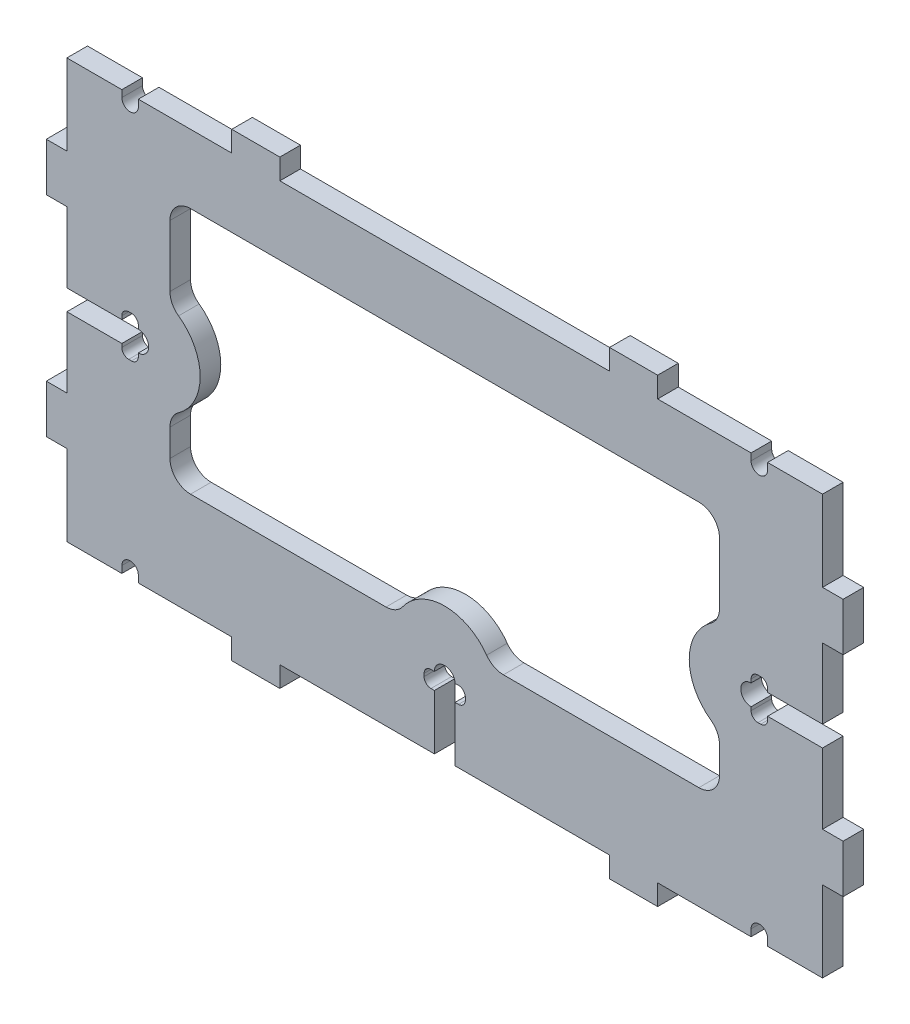
from build123d import *

# Parameters (mm, degrees)
BOSS_EXTRUDE1_DEPTH = 3
CUT_EXTRUDE1_DEPTH  = 3
CUT_EXTRUDE3_DEPTH  = 3
FILLET2_R           = 1
CUT_EXTRUDE4_DEPTH  = 10
FILLET3_R           = 3
SKETCH5_W           = 3
SKETCH5_H           = 7
SKETCH5_W_2         = 7
SKETCH5_H_2         = 3
BOSS_EXTRUDE2_DEPTH = 3


with BuildPart() as part:
    # Sketch1 → Boss-Extrude1 (new body)
    with BuildSketch(Plane.XY):
        with BuildLine():
            Line((55, 30.5), (-55, 30.5))
            Line((-55, 30.5), (-55, 1.5))
            Line((-55, 1.5), (-47, 1.5))
            Line((-47, 1.5), (-47, 2))
            Line((-47, 2), (-47, 3))
            Line((-47, 3), (-46, 3))
            Line((-46, 3), (-45.6, 3))
            Line((-45.6, 3), (-44.6, 3))
            Line((-44.6, 3), (-44.6, 2))
            Line((-44.6, 2), (-44.6, 1.5))
            ThreePointArc((-44.6, 1.5), (-43.1, 0), (-44.6, -1.5))
            Line((-44.6, -1.5), (-44.6, -2))
            Line((-44.6, -2), (-44.6, -3))
            Line((-44.6, -3), (-45.6, -3))
            Line((-45.6, -3), (-46, -3))
            Line((-46, -3), (-47, -3))
            Line((-47, -3), (-47, -2))
            Line((-47, -2), (-47, -1.5))
            Line((-47, -1.5), (-55, -1.5))
            Line((-55, -1.5), (-55, -30.5))
            Line((-55, -30.5), (55, -30.5))
            Line((55, -30.5), (55, -1.5))
            Line((55, -1.5), (47, -1.5))
            Line((47, -1.5), (47, -2))
            Line((47, -2), (47, -3))
            Line((47, -3), (46, -3))
            Line((46, -3), (45.6, -3))
            Line((45.6, -3), (44.6, -3))
            Line((44.6, -3), (44.6, -2))
            Line((44.6, -2), (44.6, -1.5))
            ThreePointArc((44.6, -1.5), (43.1, 0), (44.6, 1.5))
            Line((44.6, 1.5), (44.6, 2))
            Line((44.6, 2), (44.6, 3))
            Line((44.6, 3), (45.6, 3))
            Line((45.6, 3), (46, 3))
            Line((46, 3), (47, 3))
            Line((47, 3), (47, 2))
            Line((47, 2), (47, 1.5))
            Line((47, 1.5), (55, 1.5))
            Line((55, 1.5), (55, 30.5))
        make_face()
        with BuildLine():
            ThreePointArc((-46, -3), (-46.707106781, -2.707106781), (-47, -2))
            Line((-47, -2), (-47, -3))
            Line((-47, -3), (-46, -3))
        make_face()
        with BuildLine():
            ThreePointArc((-44.6, -2), (-44.892893219, -2.707106781), (-45.6, -3))
            Line((-45.6, -3), (-44.6, -3))
            Line((-44.6, -3), (-44.6, -2))
        make_face()
        with BuildLine():
            Line((-44.6, 3), (-45.6, 3))
            ThreePointArc((-45.6, 3), (-44.892893219, 2.707106781), (-44.6, 2))
            Line((-44.6, 2), (-44.6, 3))
        make_face()
        with BuildLine():
            Line((-47, 3), (-47, 2))
            ThreePointArc((-47, 2), (-46.707106781, 2.707106781), (-46, 3))
            Line((-46, 3), (-47, 3))
        make_face()
        with BuildLine():
            Line((44.6, -3), (45.6, -3))
            ThreePointArc((45.6, -3), (44.892893219, -2.707106781), (44.6, -2))
            Line((44.6, -2), (44.6, -3))
        make_face()
        with BuildLine():
            Line((47, -3), (47, -2))
            ThreePointArc((47, -2), (46.707106781, -2.707106781), (46, -3))
            Line((46, -3), (47, -3))
        make_face()
        with BuildLine():
            ThreePointArc((46, 3), (46.707106781, 2.707106781), (47, 2))
            Line((47, 2), (47, 3))
            Line((47, 3), (46, 3))
        make_face()
        with BuildLine():
            ThreePointArc((44.6, 2), (44.892893219, 2.707106781), (45.6, 3))
            Line((45.6, 3), (44.6, 3))
            Line((44.6, 3), (44.6, 2))
        make_face()
    extrude(amount=BOSS_EXTRUDE1_DEPTH)

    # Sketch2 → Cut-Extrude1 (cut)
    with BuildSketch(Plane.XY.offset(3)):
        with BuildLine():
            Line((45.136675042, 30.5), (44.6, 30.5))
            Line((44.6, 30.5), (44.6, 29.5))
            ThreePointArc((44.6, 29.5), (45.8, 28.3), (47, 29.5))
            Line((47, 29.5), (47, 30.5))
            Line((47, 30.5), (46.463324958, 30.5))
            Line((46.463324958, 30.5), (45.136675042, 30.5))
        make_face()
        with BuildLine():
            Line((44.6, -29.5), (44.6, -30.5))
            Line((44.6, -30.5), (45.136675042, -30.5))
            Line((45.136675042, -30.5), (46.463324958, -30.5))
            Line((46.463324958, -30.5), (47, -30.5))
            Line((47, -30.5), (47, -29.5))
            ThreePointArc((47, -29.5), (45.8, -28.3), (44.6, -29.5))
        make_face()
        with BuildLine():
            ThreePointArc((-44.6, -29.5), (-45.8, -28.3), (-47, -29.5))
            Line((-47, -29.5), (-47, -30.5))
            Line((-47, -30.5), (-46.463324958, -30.5))
            Line((-46.463324958, -30.5), (-45.136675042, -30.5))
            Line((-45.136675042, -30.5), (-44.6, -30.5))
            Line((-44.6, -30.5), (-44.6, -29.5))
        make_face()
        with BuildLine():
            Line((-47, 30.5), (-47, 29.5))
            ThreePointArc((-47, 29.5), (-45.8, 28.3), (-44.6, 29.5))
            Line((-44.6, 29.5), (-44.6, 30.5))
            Line((-44.6, 30.5), (-45.136675042, 30.5))
            Line((-45.136675042, 30.5), (-46.463324958, 30.5))
            Line((-46.463324958, 30.5), (-47, 30.5))
        make_face()
    extrude(amount=-CUT_EXTRUDE1_DEPTH, mode=Mode.SUBTRACT)

    # Sketch3 → Cut-Extrude3 (cut)
    with BuildSketch(Plane.XY.offset(3)):
        with BuildLine():
            ThreePointArc((1.5, -20.1), (0, -18.6), (-1.5, -20.1))
            Line((-1.5, -20.1), (-3, -20.1))
            Line((-3, -20.1), (-3, -22.5))
            Line((-3, -22.5), (-1.5, -22.5))
            Line((-1.5, -22.5), (-1.5, -30.5))
            Line((-1.5, -30.5), (0, -30.5))
            Line((0, -30.5), (1.5, -30.5))
            Line((1.5, -30.5), (1.5, -22.5))
            Line((1.5, -22.5), (3, -22.5))
            Line((3, -22.5), (3, -20.1))
            Line((3, -20.1), (1.5, -20.1))
        make_face()
    extrude(amount=-CUT_EXTRUDE3_DEPTH, mode=Mode.SUBTRACT)

    # Fillet2
    fillet2_edges = [part.edges().sort_by_distance(p)[0] for p in [
        (3, -20.1, 1.5),
        (3, -22.5, 1.5),
        (-3, -22.5, 1.5),
        (-3, -20.1, 1.5),
    ]]
    fillet(fillet2_edges, radius=FILLET2_R)

    # Sketch4 → Cut-Extrude4 (cut)
    with BuildSketch(Plane.XY.offset(3)):
        with BuildLine():
            Line((40, 20.5), (-40, 20.5))
            Line((-40, 20.5), (-40, 6.829348432))
            ThreePointArc((-40, 6.829348432), (-36.795239894, 4.062019202), (-35.6, 0))
            ThreePointArc((-35.6, 0), (-36.795239894, -4.062019202), (-40, -6.829348432))
            Line((-40, -6.829348432), (-40, -15.5))
            Line((-40, -15.5), (-6.829348432, -15.5))
            ThreePointArc((-6.829348432, -15.5), (0, -11.1), (6.829348432, -15.5))
            Line((6.829348432, -15.5), (40, -15.5))
            Line((40, -15.5), (40, -6.829348432))
            ThreePointArc((40, -6.829348432), (35.6, 0), (40, 6.829348432))
            Line((40, 6.829348432), (40, 20.5))
        make_face()
    extrude(amount=-CUT_EXTRUDE4_DEPTH, mode=Mode.SUBTRACT)

    # Fillet3
    fillet3_edges = [part.edges().sort_by_distance(p)[0] for p in [
        (40, 6.829348432, 1.5),
        (40, -6.829348432, 1.5),
        (40, -15.5, 1.5),
        (6.829348432, -15.5, 1.5),
        (-6.829348432, -15.5, 1.5),
        (-40, -15.5, 1.5),
        (-40, -6.829348432, 1.5),
        (-40, 6.829348432, 1.5),
        (-40, 20.5, 1.5),
        (40, 20.5, 1.5),
    ]]
    fillet(fillet3_edges, radius=FILLET3_R)

    # Sketch5 → Boss-Extrude2 (add)
    with BuildSketch(Plane.XY.offset(3)):
        with Locations((-56.5, 15.25)):
            Rectangle(SKETCH5_W, SKETCH5_H)
        with Locations((-56.5, -15.25)):
            Rectangle(SKETCH5_W, SKETCH5_H)
        with Locations((56.5, -15.25)):
            Rectangle(SKETCH5_W, SKETCH5_H)
        with Locations((56.5, 15.25)):
            Rectangle(SKETCH5_W, SKETCH5_H)
        with Locations((27.5, -32)):
            Rectangle(SKETCH5_W_2, SKETCH5_H_2)
        with Locations((-27.5, -32)):
            Rectangle(SKETCH5_W_2, SKETCH5_H_2)
        with Locations((-27.5, 32)):
            Rectangle(SKETCH5_W_2, SKETCH5_H_2)
        with Locations((27.5, 32)):
            Rectangle(SKETCH5_W_2, SKETCH5_H_2)
    extrude(amount=-BOSS_EXTRUDE2_DEPTH)


solid = part.part
